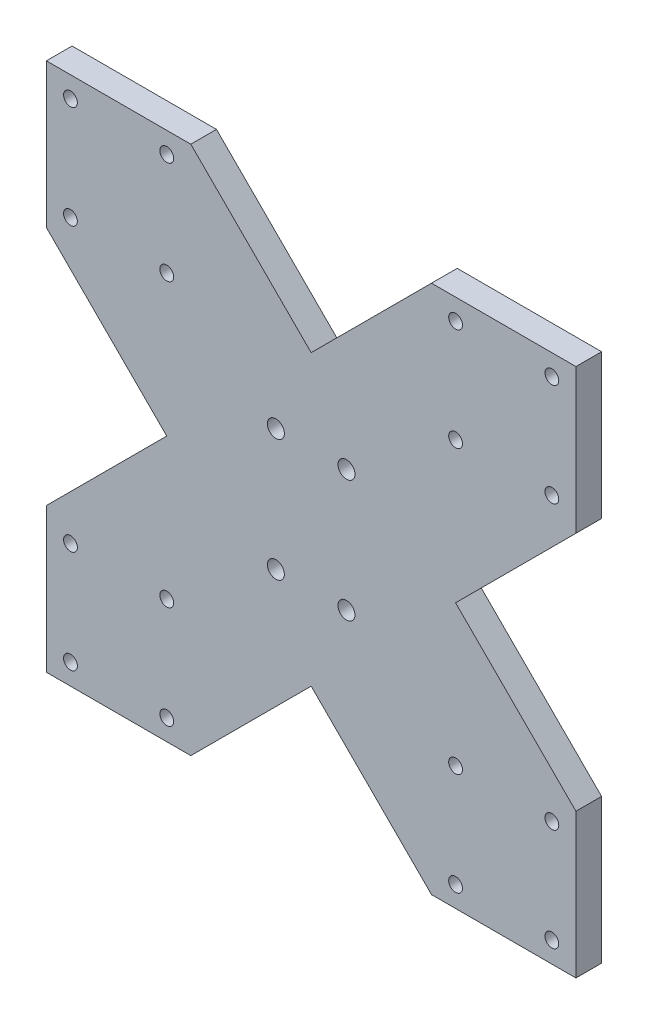
from build123d import *

# Parameters (mm, degrees)
BOSS_EXTRUDE1_DEPTH  = 8
M4_CLEARANCE_HOLE1_D = 4.3
M5_CLEARANCE_HOLE1_D = 5.3


with BuildPart() as part:
    # Sketch1 → Boss-Extrude1 (new body)
    with BuildSketch(Plane.XY):
        Polygon((-82.5, 37.5), (-45, 0), (-82.5, -37.5), (-82.5, -82.5), (-37.5, -82.5), (0, -45), (37.5, -82.5), (82.5, -82.5), (82.5, -37.5), (45, 0), (82.5, 37.5), (82.5, 82.5), (37.5, 82.5), (0, 45), (-37.5, 82.5), (-82.5, 82.5), align=None)
    extrude(amount=BOSS_EXTRUDE1_DEPTH)

    # M4 Clearance Hole1 (through all)
    with Locations(Plane.XY.offset(8)):
        with Locations((-75, 76), (-45, 76), (-45, 44), (-75, 44), (-75, -44), (-45, -44), (-45, -76), (-75, -76), (75, -76), (45, -76), (45, -44), (75, -44), (75, 44), (45, 44), (45, 76), (75, 76)):
            Hole(M4_CLEARANCE_HOLE1_D / 2)

    # M5 Clearance Hole1 (through all)
    with Locations(Plane.XY.offset(8)):
        with Locations((-11, 19), (-11, -19), (11, -19), (11, 19)):
            Hole(M5_CLEARANCE_HOLE1_D / 2)


solid = part.part
